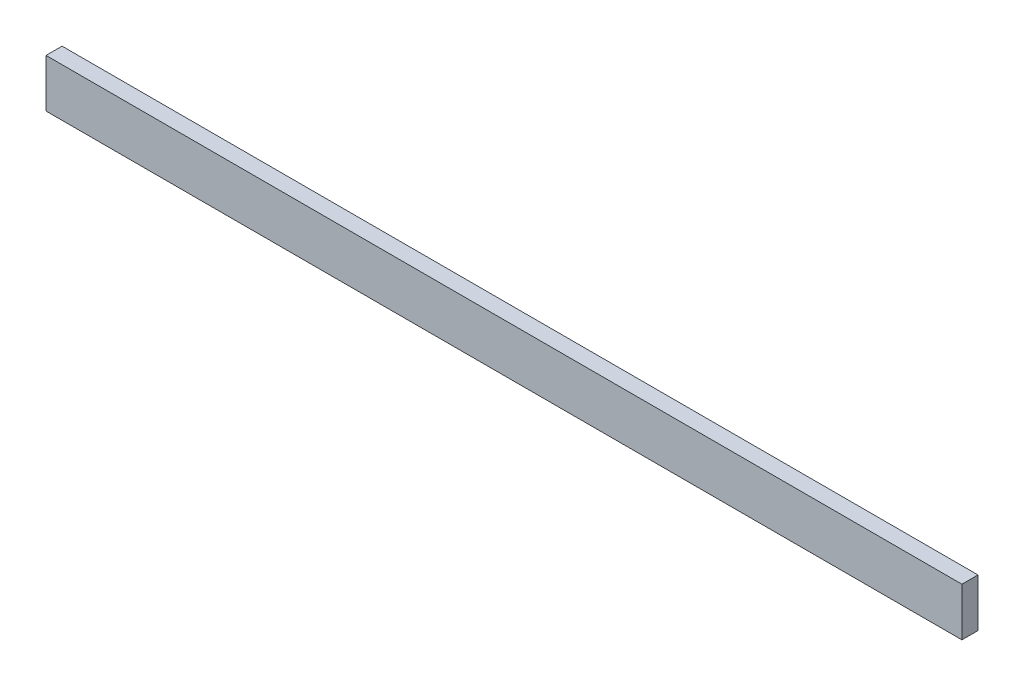
from build123d import *

# Parameters (mm, degrees)
SKETCH2_W           = 723.9
SKETCH2_H           = 38.1
BOSS_EXTRUDE1_DEPTH = 12.7


with BuildPart() as part:
    # Sketch2 → Boss-Extrude1 (new body)
    with BuildSketch(Plane.XY):
        with Locations((361.95, 19.05)):
            Rectangle(SKETCH2_W, SKETCH2_H)
    extrude(amount=BOSS_EXTRUDE1_DEPTH)


solid = part.part
